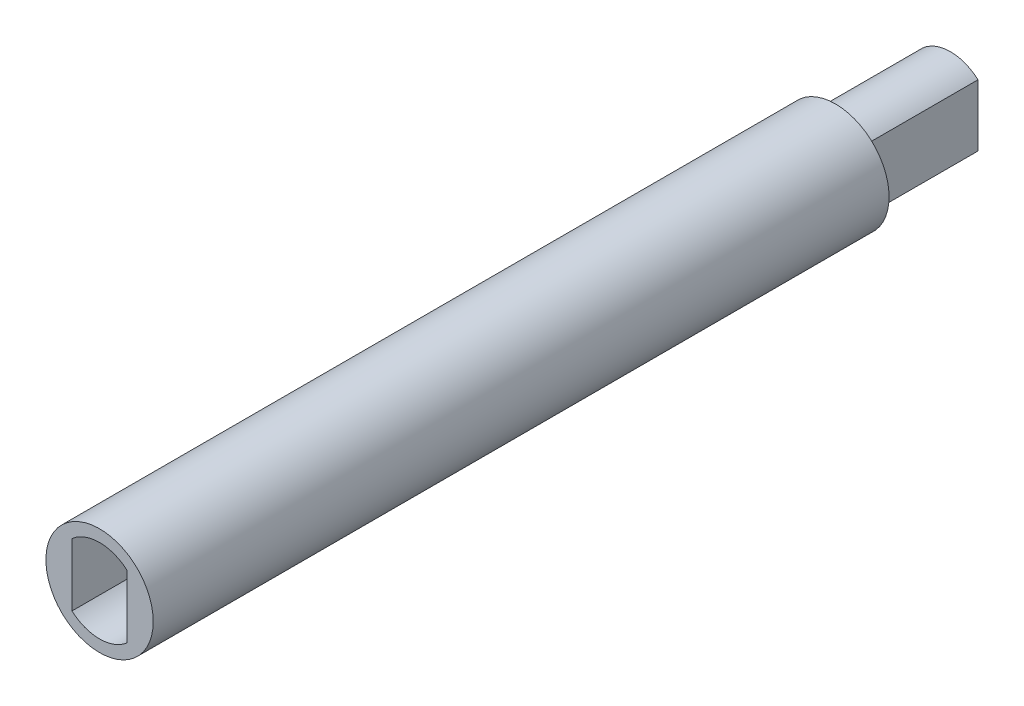
from build123d import *

# Parameters (mm, degrees)
CROQUIS1_R              = 3.5
SALIENTE_EXTRUIR1_DEPTH = 65.5
CORTAR_EXTRUIR3_DEPTH   = 8
CORTAR_EXTRUIR5_START   = -20
CROQUIS7_R              = 3.5
CORTAR_EXTRUIR5_DEPTH   = 20
CROQUIS8_W              = 12.617225576
CROQUIS8_H              = 9.28288649
CORTAR_EXTRUIR6_DEPTH   = 10
SALIENTE_EXTRUIR2_START = 2.5
CROQUIS10_R             = 3.5
SALIENTE_EXTRUIR2_DEPTH = 2.5


with BuildPart() as part:
    # Croquis1 → Saliente-Extruir1 (new body)
    with BuildSketch(Plane.XY):
        Circle(CROQUIS1_R)
    extrude(amount=-SALIENTE_EXTRUIR1_DEPTH)

    # Croquis6 → Cortar-Extruir3 (cut)
    with BuildSketch(Plane.XY):
        with BuildLine():
            Line((-1.8, 2.045880006), (-1.8, -2.045880006))
            ThreePointArc((-1.8, -2.045880006), (0, -2.725), (1.8, -2.045880006))
            Line((1.8, -2.045880006), (1.8, 2.045880006))
            ThreePointArc((1.8, 2.045880006), (0, 2.725), (-1.8, 2.045880006))
        make_face()
    extrude(amount=-CORTAR_EXTRUIR3_DEPTH, mode=Mode.SUBTRACT)

    # Croquis7 → Cortar-Extruir5 (cut)
    with BuildSketch(Plane(origin=(0, 0, -65.5), x_dir=(-1, 0, 0), z_dir=(0, 0, -1)).offset(CORTAR_EXTRUIR5_START)):
        with Locations(Location((0, 0, 0), (0, 0, 180))):
            Circle(CROQUIS7_R)
        with BuildLine():
            ThreePointArc((1.8, 2.01246118), (0, 2.7), (-1.8, 2.01246118))
            Line((-1.8, 2.01246118), (-1.8, -2.01246118))
            ThreePointArc((-1.8, -2.01246118), (0, -2.7), (1.8, -2.01246118))
            Line((1.8, -2.01246118), (1.8, 2.01246118))
        make_face(mode=Mode.SUBTRACT)
    extrude(amount=CORTAR_EXTRUIR5_DEPTH, mode=Mode.SUBTRACT)

    # Croquis8 → Cortar-Extruir6 (cut)
    with BuildSketch(Plane.ZY.offset(1.8)):
        with Locations((-59.308612788, -0.436721269)):
            Rectangle(CROQUIS8_W, CROQUIS8_H)
    extrude(amount=-CORTAR_EXTRUIR6_DEPTH, mode=Mode.SUBTRACT)

    # Croquis10 → Saliente-Extruir2 (add)
    with BuildSketch(Plane.XY.offset(SALIENTE_EXTRUIR2_START)):
        Circle(CROQUIS10_R)
        with BuildLine():
            Line((-1.8, 2.045880006), (-1.8, -2.045880006))
            ThreePointArc((-1.8, -2.045880006), (0, -2.725), (1.8, -2.045880006))
            Line((1.8, -2.045880006), (1.8, 2.045880006))
            ThreePointArc((1.8, 2.045880006), (0, 2.725), (-1.8, 2.045880006))
        make_face(mode=Mode.SUBTRACT)
    extrude(amount=-SALIENTE_EXTRUIR2_DEPTH)


solid = part.part
